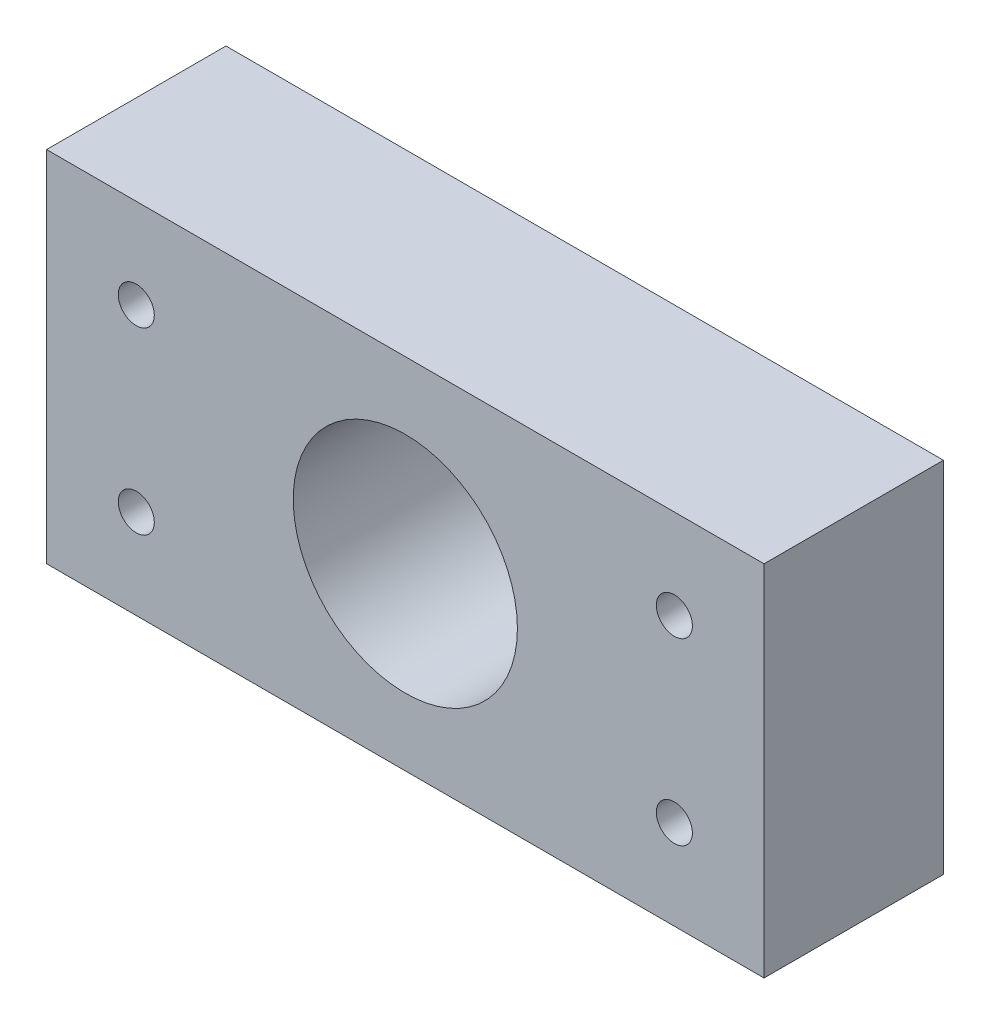
from build123d import *

# Parameters (mm, degrees)
SKETCH1_W               = 101.6
SKETCH1_H               = 25.4
BOSS_EXTRUDE1_DEPTH     = 25.4
CUT_EXTRUDE1_REACH      = 64.217
SKETCH2_R               = 15.875
F_1_4_20_TAPPED_HOLE1_D = 5.1054


with BuildPart() as part:
    # Sketch1 → Boss-Extrude1 (new, symmetric)
    with BuildSketch(Plane(origin=(0, 0, 0), x_dir=(1, 0, 0), z_dir=(0, 1, 0))):
        Rectangle(SKETCH1_W, SKETCH1_H)
    extrude(amount=BOSS_EXTRUDE1_DEPTH, both=True)

    # Sketch2 → Cut-Extrude1 (cut, up to next)
    with BuildSketch(Plane.XY.offset(12.7), mode=Mode.PRIVATE) as cut_extrude1_sk1:
        Circle(SKETCH2_R)
    cut_extrude1_tool1 = extrude(cut_extrude1_sk1.sketch, amount=-CUT_EXTRUDE1_REACH, mode=Mode.PRIVATE) & part.part
    add(cut_extrude1_tool1.solids().sort_by_distance((0, 0, 12.7))[0], mode=Mode.SUBTRACT)

    # 1/4-20 Tapped Hole1 (through all)
    with Locations(Plane.XY.offset(12.7)):
        with Locations((-38.1, 12.7), (-38.1, -12.7), (38.1, 12.7), (38.1, -12.7)):
            Hole(F_1_4_20_TAPPED_HOLE1_D / 2)


solid = part.part
